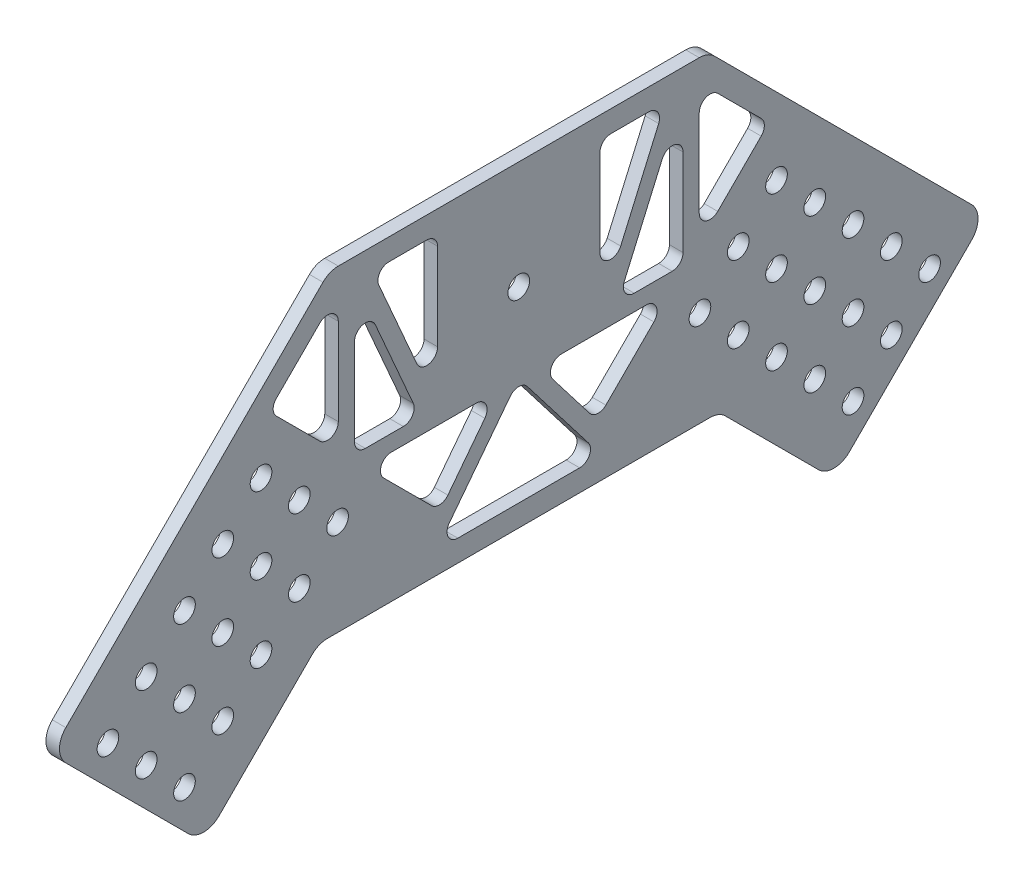
from build123d import *

# Parameters (mm, degrees)
SKETCH7_R           = 2.54
BOSS_EXTRUDE1_DEPTH = 3.175
FILLET1_R           = 2.54
FILLET2_R           = 5.08


with BuildPart() as part:
    # Sketch7 → Boss-Extrude1 (new body)
    with BuildSketch(Plane(origin=(0, 0, 0), x_dir=(0, 0, -1), z_dir=(1, 0, 0))):
        Polygon((307.056403027, 247.914354058), (333.99717139, 274.855122421), (428.00282861, 274.855122421), (454.943596973, 247.914354058), (490.864621458, 283.835378542), (425.45, 349.25), (336.55, 349.25), (271.135378542, 283.835378542), align=None)
        with Locations((284.605762724, 279.345250482)):
            Circle(SKETCH7_R, mode=Mode.SUBTRACT)
        with Locations((293.586018845, 288.325506603)):
            Circle(SKETCH7_R, mode=Mode.SUBTRACT)
        with Locations((302.566274966, 297.305762724)):
            Circle(SKETCH7_R, mode=Mode.SUBTRACT)
        with Locations((311.546531087, 306.286018845)):
            Circle(SKETCH7_R, mode=Mode.SUBTRACT)
        with Locations((320.526787208, 315.266274966)):
            Circle(SKETCH7_R, mode=Mode.SUBTRACT)
        with Locations((302.566274966, 279.345250482)):
            Circle(SKETCH7_R, mode=Mode.SUBTRACT)
        with Locations((311.546531087, 288.325506603)):
            Circle(SKETCH7_R, mode=Mode.SUBTRACT)
        with Locations((320.526787208, 297.305762724)):
            Circle(SKETCH7_R, mode=Mode.SUBTRACT)
        with Locations((329.507043329, 306.286018845)):
            Circle(SKETCH7_R, mode=Mode.SUBTRACT)
        with Locations((311.546531087, 270.364994361)):
            Circle(SKETCH7_R, mode=Mode.SUBTRACT)
        with Locations((320.526787208, 279.345250482)):
            Circle(SKETCH7_R, mode=Mode.SUBTRACT)
        with Locations((329.507043329, 288.325506603)):
            Circle(SKETCH7_R, mode=Mode.SUBTRACT)
        with Locations((338.48729945, 297.305762724)):
            Circle(SKETCH7_R, mode=Mode.SUBTRACT)
        with Locations((293.586018845, 270.364994361)):
            Circle(SKETCH7_R, mode=Mode.SUBTRACT)
        with Locations((302.566274966, 261.38473824)):
            Circle(SKETCH7_R, mode=Mode.SUBTRACT)
        with Locations((477.394237276, 279.345250482)):
            Circle(SKETCH7_R, mode=Mode.SUBTRACT)
        with Locations((468.413981155, 288.325506603)):
            Circle(SKETCH7_R, mode=Mode.SUBTRACT)
        with Locations((459.433725034, 297.305762724)):
            Circle(SKETCH7_R, mode=Mode.SUBTRACT)
        with Locations((450.453468913, 306.286018845)):
            Circle(SKETCH7_R, mode=Mode.SUBTRACT)
        with Locations((441.473212792, 315.266274966)):
            Circle(SKETCH7_R, mode=Mode.SUBTRACT)
        with Locations((459.433725034, 279.345250482)):
            Circle(SKETCH7_R, mode=Mode.SUBTRACT)
        with Locations((450.453468913, 288.325506603)):
            Circle(SKETCH7_R, mode=Mode.SUBTRACT)
        with Locations((441.473212792, 297.305762724)):
            Circle(SKETCH7_R, mode=Mode.SUBTRACT)
        with Locations((432.492956671, 306.286018845)):
            Circle(SKETCH7_R, mode=Mode.SUBTRACT)
        with Locations((450.453468913, 270.364994361)):
            Circle(SKETCH7_R, mode=Mode.SUBTRACT)
        with Locations((441.473212792, 279.345250482)):
            Circle(SKETCH7_R, mode=Mode.SUBTRACT)
        with Locations((432.492956671, 288.325506603)):
            Circle(SKETCH7_R, mode=Mode.SUBTRACT)
        with Locations((423.51270055, 297.305762724)):
            Circle(SKETCH7_R, mode=Mode.SUBTRACT)
        with Locations((468.413981155, 270.364994361)):
            Circle(SKETCH7_R, mode=Mode.SUBTRACT)
        with Locations((459.433725034, 261.38473824)):
            Circle(SKETCH7_R, mode=Mode.SUBTRACT)
        with Locations((381, 323.85)):
            Circle(SKETCH7_R, mode=Mode.SUBTRACT)
        Polygon((322.322838433, 327.838633536), (338.654204897, 344.17), (338.654204897, 311.507267071), align=None, mode=Mode.SUBTRACT)
        Polygon((342.464204897, 344.17), (342.464204897, 309.023397149), (357.793385063, 309.023397149), align=None, mode=Mode.SUBTRACT)
        Polygon((346.620819834, 344.17), (361.95, 344.17), (361.95, 309.023397149), align=None, mode=Mode.SUBTRACT)
        Polygon((344.94807482, 305.213397149), (362.606349547, 287.555122421), (376.192769102, 305.213397149), align=None, mode=Mode.SUBTRACT)
        Polygon((400.449309255, 279.935122421), (361.550690745, 279.935122421), (381, 305.213397149), align=None, mode=Mode.SUBTRACT)
        Polygon((400.05, 309.023397149), (400.05, 344.17), (415.379180166, 344.17), align=None, mode=Mode.SUBTRACT)
        Polygon((385.807230898, 305.213397149), (417.05192518, 305.213397149), (399.393650453, 287.555122421), align=None, mode=Mode.SUBTRACT)
        Polygon((404.206614937, 309.023397149), (419.535795103, 344.17), (419.535795103, 309.023397149), align=None, mode=Mode.SUBTRACT)
        Polygon((423.345795103, 311.507267071), (439.677161567, 327.838633536), (423.345795103, 344.17), align=None, mode=Mode.SUBTRACT)
    extrude(amount=BOSS_EXTRUDE1_DEPTH)

    # Fillet1
    fillet1_edges = [part.edges().sort_by_distance(p)[0] for p in [
        (1.5875, 309.023397149, -404.206614937),
        (1.5875, 309.023397149, -419.535795103),
        (1.5875, 344.17, -419.535795103),
        (1.5875, 305.213397149, -385.807230898),
        (1.5875, 287.555122421, -399.393650453),
        (1.5875, 305.213397149, -417.05192518),
        (1.5875, 344.17, -338.654204897),
        (1.5875, 327.838633536, -322.322838433),
        (1.5875, 311.507267071, -338.654204897),
        (1.5875, 344.17, -342.464204897),
        (1.5875, 309.023397149, -342.464204897),
        (1.5875, 309.023397149, -357.793385063),
        (1.5875, 305.213397149, -344.94807482),
        (1.5875, 287.555122421, -362.606349547),
        (1.5875, 305.213397149, -376.192769102),
        (1.5875, 344.17, -361.95),
        (1.5875, 344.17, -346.620819834),
        (1.5875, 309.023397149, -361.95),
        (1.5875, 305.213397149, -381),
        (1.5875, 279.935122421, -361.550690745),
        (1.5875, 279.935122421, -400.449309255),
        (1.5875, 344.17, -400.05),
        (1.5875, 309.023397149, -400.05),
        (1.5875, 344.17, -415.379180166),
        (1.5875, 344.17, -423.345795103),
        (1.5875, 311.507267071, -423.345795103),
        (1.5875, 327.838633536, -439.677161567),
    ]]
    fillet(fillet1_edges, radius=FILLET1_R)

    # Fillet2
    fillet2_edges = [part.edges().sort_by_distance(p)[0] for p in [
        (1.5875, 349.25, -425.45),
        (1.5875, 283.835378542, -490.864621458),
        (1.5875, 247.914354058, -454.943596973),
        (1.5875, 274.855122421, -428.00282861),
        (1.5875, 274.855122421, -333.99717139),
        (1.5875, 247.914354058, -307.056403027),
        (1.5875, 283.835378542, -271.135378542),
        (1.5875, 349.25, -336.55),
    ]]
    fillet(fillet2_edges, radius=FILLET2_R)


solid = part.part
